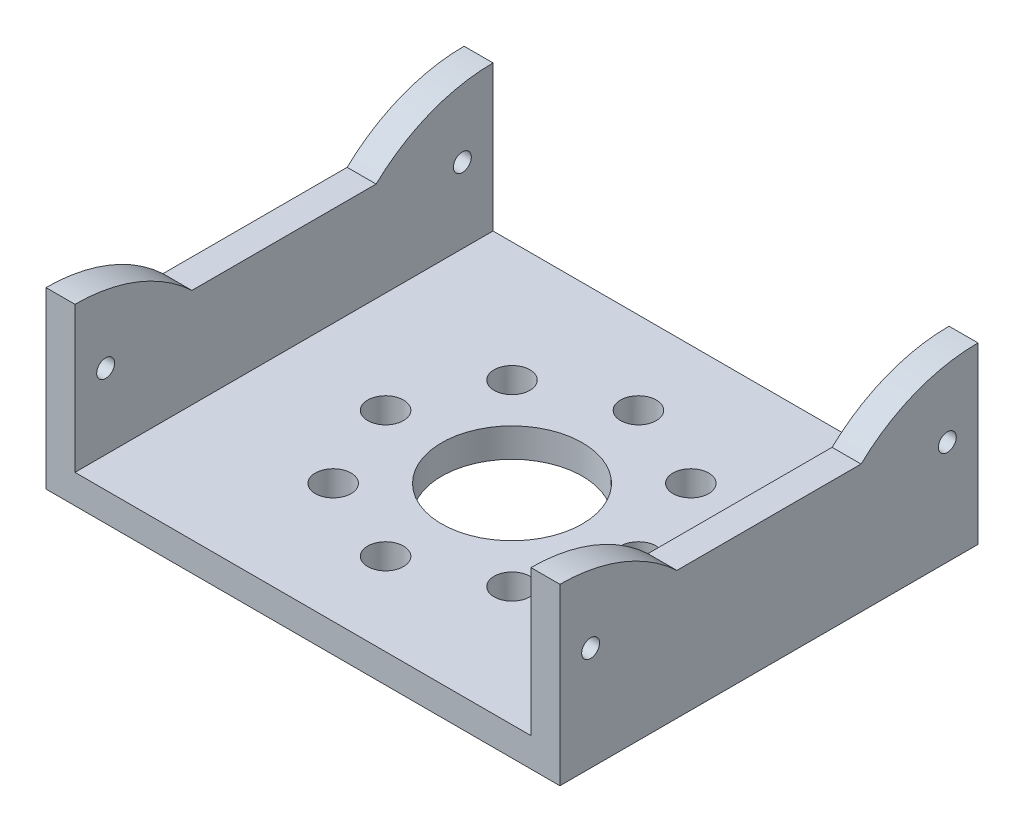
from build123d import *

# Parameters (mm, degrees)
BOSS_EXTRUDE1_DEPTH = 23.38
SKETCH2_R           = 0.5
CUT_EXTRUDE1_DEPTH  = 44.5
SKETCH3_R           = 1
SKETCH3_R_2         = 3.935
CUT_EXTRUDE2_DEPTH  = 20.5


with BuildPart() as part:
    # Sketch1 → Boss-Extrude1 (new body)
    with BuildSketch(Plane.XY):
        Polygon((0, 0), (-14.37, 0), (-14.37, 9.76), (-12.75, 9.76), (-12.75, 1.62), (0, 1.62), align=None)
    boss_extrude1 = extrude(amount=BOSS_EXTRUDE1_DEPTH)

    # Sketch2 → Cut-Extrude1 (cut)
    with BuildSketch(Plane.ZY.offset(14.37)):
        with Locations((1.715, 5.81)):
            Circle(SKETCH2_R)
        with Locations((21.665, 5.81)):
            Circle(SKETCH2_R)
        with BuildLine():
            Line((6.539942279, 7.163555861), (16.840057721, 7.163555861))
            ThreePointArc((16.840057721, 7.163555861), (19.861748759, 9.087147646), (23.38, 9.76))
            Line((23.38, 9.76), (23.38, 14.744822673))
            Line((23.38, 14.744822673), (0, 14.744822673))
            Line((0, 14.744822673), (0, 9.76))
            ThreePointArc((0, 9.76), (3.518251241, 9.087147646), (6.539942279, 7.163555861))
        make_face()
    cut_extrude1 = extrude(amount=-CUT_EXTRUDE1_DEPTH, mode=Mode.SUBTRACT)

    # Mirror1: Boss-Extrude1, Cut-Extrude1 across plane
    add(boss_extrude1.mirror(Plane(origin=(0, 1.62, 23.38), x_dir=(0, 0, 1), z_dir=(-1, 0, 0))))
    add(cut_extrude1.mirror(Plane(origin=(0, 1.62, 23.38), x_dir=(0, 0, 1), z_dir=(-1, 0, 0))), mode=Mode.SUBTRACT)

    # Sketch3 → Cut-Extrude2 (cut)
    with BuildSketch(Plane(origin=(0, 0, 0), x_dir=(1, 0, 0), z_dir=(0, 1, 0))):
        with Locations((-7.071067812, -11.69)):
            Circle(SKETCH3_R)
        with Locations((7.071067812, -11.69)):
            Circle(SKETCH3_R)
        with Locations((5, -6.69)):
            Circle(SKETCH3_R)
        with Locations((-5, -6.69)):
            Circle(SKETCH3_R)
        with Locations((0, -11.69)):
            Circle(SKETCH3_R_2)
        with Locations((-5, -16.69)):
            Circle(SKETCH3_R)
        with Locations((5, -16.69)):
            Circle(SKETCH3_R)
        with Locations((0, -18.761067812)):
            Circle(SKETCH3_R)
        with Locations((0, -4.618932188)):
            Circle(SKETCH3_R)
    extrude(amount=CUT_EXTRUDE2_DEPTH, mode=Mode.SUBTRACT)


solid = part.part
